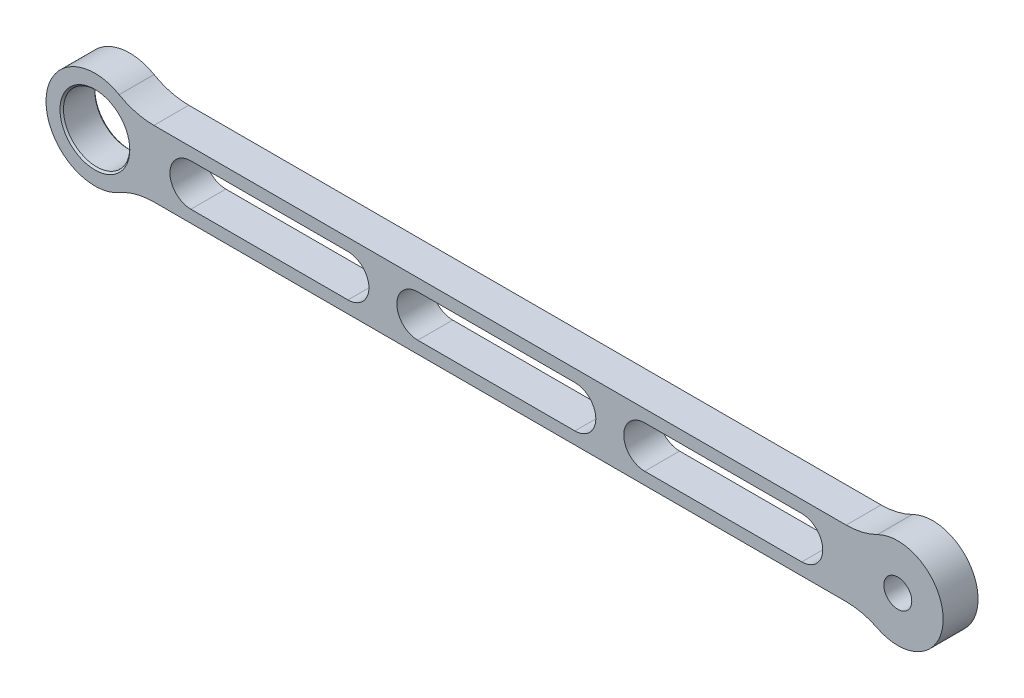
from build123d import *

# Parameters (mm, degrees)
SKETCH_1_R          = 9.5
EXTRUDE_1_DEPTH     = 10
CHAMFER_1_SIZE      = 0.5
CUT_EXTRUDE_2_DEPTH = 10
EXTRUDE_START       = -10
SKETCH_3_R          = 9.5
SKETCH_3_R_2        = 4
EXTRUDE_2_DEPTH     = 10
SKETCH_4_R          = 6
CUT_EXTRUDE_3_DEPTH = 10
SKETCH_5_R          = 6
SKETCH_5_R_2        = 4
EXTRUDE_3_DEPTH     = 10


with BuildPart() as part:
    # 草图1 → 凸台-拉伸1 (new body)
    with BuildSketch(Plane.XY):
        with BuildLine():
            Line((16.904141504, -9.5), (212.802616478, -9.5))
            Line((212.802616478, -9.5), (215.209800542, -9.5))
            ThreePointArc((215.209800542, -9.5), (219.815462407, -10.037526396), (224.173557789, -11.621212121))
            ThreePointArc((224.173557789, -11.621212121), (243, 0), (224.173557789, 11.621212121))
            ThreePointArc((224.173557789, 11.621212121), (219.815462407, 10.037526396), (215.209800542, 9.5))
            Line((215.209800542, 9.5), (212.802616478, 9.5))
            Line((212.802616478, 9.5), (16.904141504, 9.5))
            ThreePointArc((16.904141504, 9.5), (11.75918395, 10.173090993), (6.960528855, 12.147058824))
            ThreePointArc((6.960528855, 12.147058824), (-14, 0), (6.960528855, -12.147058824))
            ThreePointArc((6.960528855, -12.147058824), (11.75918395, -10.173090993), (16.904141504, -9.5))
        make_face()
        Circle(SKETCH_1_R, mode=Mode.SUBTRACT)
        with Locations((230, 0)):
            Circle(SKETCH_1_R, mode=Mode.SUBTRACT)
    extrude(amount=EXTRUDE_1_DEPTH)

    # 倒角1
    chamfer_1_edges = [part.edges().sort_by_distance(p)[0] for p in [
        (-9.5, 0, 0),
        (-9.5, 0, 10),
    ]]
    chamfer(chamfer_1_edges, length=CHAMFER_1_SIZE)

    # 草图2 → 切除-拉伸2 (cut)
    with BuildSketch(Plane.XY.offset(10)):
        with BuildLine():
            Line((137.499999918, -6), (92.5, -6))
            ThreePointArc((92.5, -6), (86.5, 0), (92.5, 6))
            Line((92.5, 6), (137.499999918, 6))
            ThreePointArc((137.499999918, 6), (143.499999918, 0), (137.499999918, -6))
        make_face()
        with BuildLine():
            Line((27.5, -6), (72.5, -6))
            ThreePointArc((72.5, -6), (78.5, 0), (72.5, 6))
            Line((72.5, 6), (27.5, 6))
            ThreePointArc((27.5, 6), (21.5, 0), (27.5, -6))
        make_face()
        with BuildLine():
            Line((157.5, -6), (202.5, -6))
            ThreePointArc((202.5, -6), (208.5, 0), (202.5, 6))
            Line((202.5, 6), (157.5, 6))
            ThreePointArc((157.5, 6), (151.5, 0), (157.5, -6))
        make_face()
    extrude(amount=-CUT_EXTRUDE_2_DEPTH, mode=Mode.SUBTRACT)

    # 草图3 → 凸台-拉伸2 (add)
    with BuildSketch(Plane.XY.offset(10).offset(EXTRUDE_START)):
        with Locations((230, 0)):
            Circle(SKETCH_3_R)
        with Locations((230, 0)):
            Circle(SKETCH_3_R_2, mode=Mode.SUBTRACT)
    extrude(amount=EXTRUDE_2_DEPTH)

    # 草图4 → 切除-拉伸3 (cut)
    with BuildSketch(Plane.XY.offset(10)):
        with Locations((230, 0)):
            Circle(SKETCH_4_R)
    extrude(amount=-CUT_EXTRUDE_3_DEPTH, mode=Mode.SUBTRACT)

    # 草图5 → 凸台-拉伸3 (add)
    with BuildSketch(Plane.XY.offset(10)):
        with Locations((230, 0)):
            Circle(SKETCH_5_R)
        with Locations((230, 0)):
            Circle(SKETCH_5_R_2, mode=Mode.SUBTRACT)
    extrude(amount=-EXTRUDE_3_DEPTH)


solid = part.part
